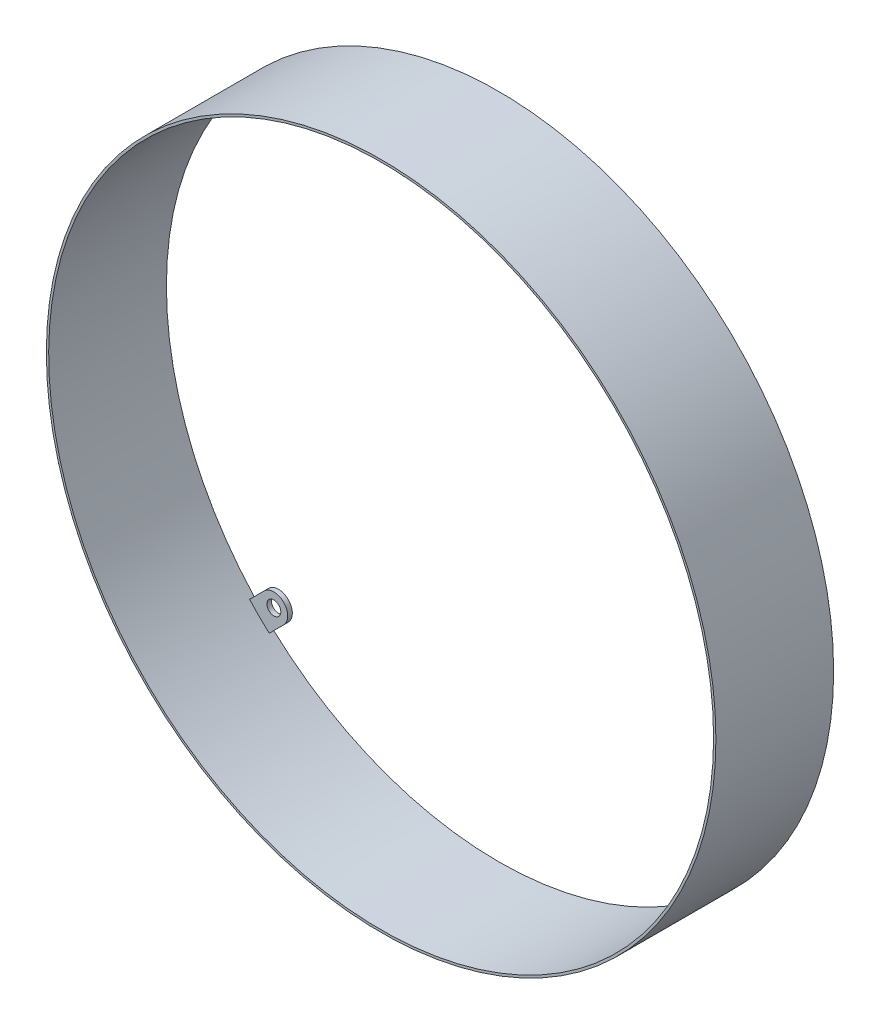
from build123d import *

# Parameters (mm, degrees)
SKIZZE1_R          = 72.5
SKIZZE1_R_2        = 72
COVER_RING_DEPTH   = 25.5
SKIZZE2_R          = 1.5
SPACER_SCREW_DEPTH = 1
KREISMUSTER1_COUNT = 4


with BuildPart() as part:
    # Skizze1 → Cover Ring (new body)
    with BuildSketch(Plane.XY):
        Circle(SKIZZE1_R)
        Circle(SKIZZE1_R_2, mode=Mode.SUBTRACT)
    extrude(amount=COVER_RING_DEPTH)

    # Skizze2 → Spacer Screw (add)
    with BuildSketch(Plane.XY):
        with BuildLine():
            Line((48.790367902, 53.033008589), (45.608387387, 49.851028074))
            ThreePointArc((45.608387387, 49.851028074), (45.608387387, 45.608387387), (49.851028074, 45.608387387))
            Line((49.851028074, 45.608387387), (53.033008589, 48.790367902))
            Line((53.033008589, 48.790367902), (48.790367902, 53.033008589))
        make_face()
        with Locations((47.72970773, 47.72970773)):
            Circle(SKIZZE2_R, mode=Mode.SUBTRACT)
    spacer_screw = extrude(amount=SPACER_SCREW_DEPTH)

    # Kreismuster1: Spacer Screw ×4 about axis
    kreismuster1_axis = Axis((0, 0, 0), (0, 0, 1))
    for i in range(1, KREISMUSTER1_COUNT):
        add(spacer_screw.rotate(kreismuster1_axis, i * 360 / KREISMUSTER1_COUNT))


solid = part.part
